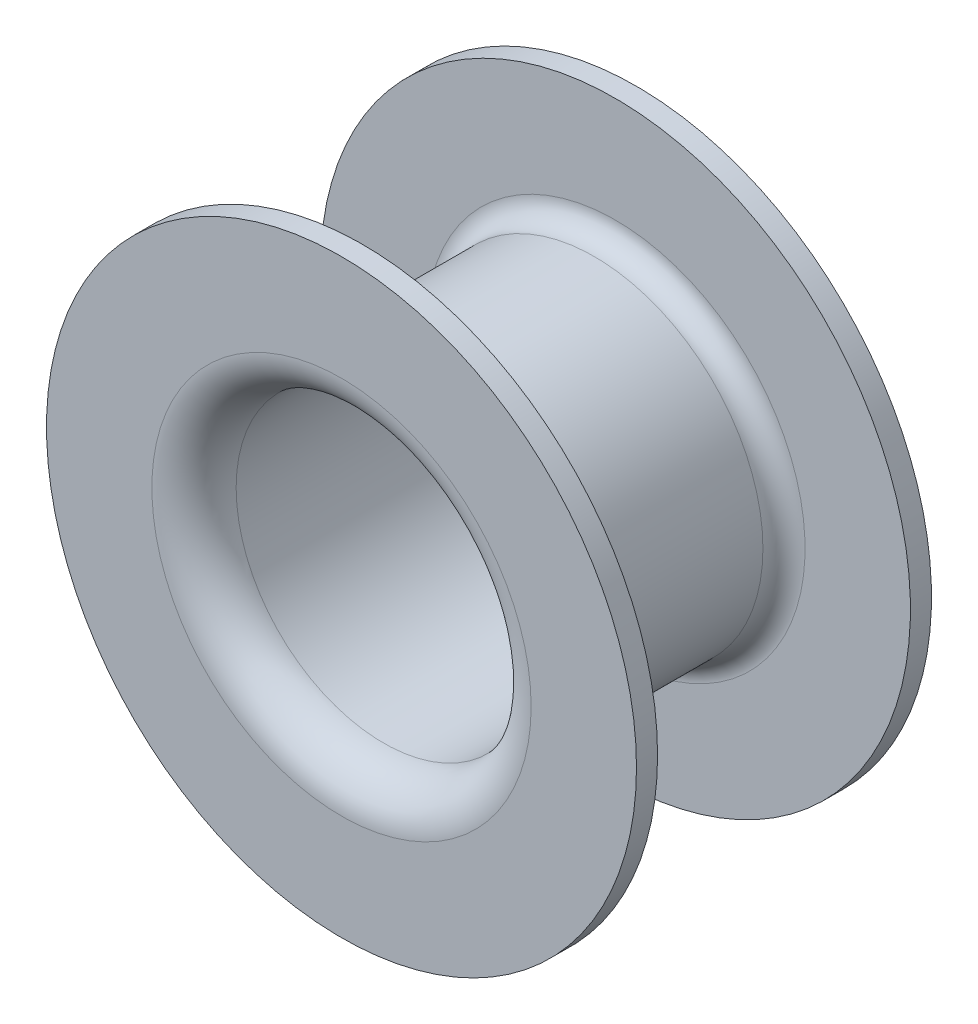
from build123d import *
from build123d.topology import SkipClean

# Parameters (mm, degrees)
SKETCH_1_R      = 3.5
SKETCH_1_R_2    = 1.75
EXTRUDE_1_DEPTH = 0.25
EXTRUDE_START   = 3
SKETCH_2_R      = 2
SKETCH_2_R_2    = 1.75
EXTRUDE_2_DEPTH = 3
EXTRUDE_START_2 = 0.25
SKETCH_3_R      = 3.5
SKETCH_3_R_2    = 1.75
EXTRUDE_3_DEPTH = 0.25
FILLET_1_R      = 0.25
FILLET_2_R      = 0.5


with BuildPart() as part:
    # Эскиз1 → Вытянуть1 (new body)
    with BuildSketch(Plane.XY):
        Circle(SKETCH_1_R)
        Circle(SKETCH_1_R_2, mode=Mode.SUBTRACT)
    extrude(amount=EXTRUDE_1_DEPTH)

    # Эскиз2 → Вытянуть2 (add)
    with SkipClean():  # the faces are left unmerged after this step: merging them gives an invalid solid
        with BuildSketch(Plane(origin=(0, 0, 0), x_dir=(-1, 0, 0), z_dir=(0, 0, -1)).offset(EXTRUDE_START)):
            with Locations(Location((0, 0, 0), (0, 0, 180))):
                Circle(SKETCH_2_R)
            Circle(SKETCH_2_R_2, mode=Mode.SUBTRACT)
        extrude(amount=-EXTRUDE_2_DEPTH)

    # Эскиз3 → Вытянуть3 (add)
    with SkipClean():  # the faces are left unmerged after this step: merging them gives an invalid solid
        with BuildSketch(Plane(origin=(0, 0, -3), x_dir=(-1, 0, 0), z_dir=(0, 0, -1)).offset(EXTRUDE_START_2)):
            with Locations(Location((0, 0, 0), (0, 0, 180))):
                Circle(SKETCH_3_R)
            Circle(SKETCH_3_R_2, mode=Mode.SUBTRACT)
        extrude(amount=-EXTRUDE_3_DEPTH)

    # Скругление1
    fillet_1_edges = [part.edges().sort_by_distance(p)[0] for p in [
        (-2, 0, -3),
        (-2, 0, 0),
    ]]
    fillet(fillet_1_edges, radius=FILLET_1_R)

    # Скругление2
    fillet_2_edges = [part.edges().sort_by_distance(p)[0] for p in [
        (1.75, 0, -3.25),
        (-1.75, 0, 0.25),
    ]]
    fillet(fillet_2_edges, radius=FILLET_2_R)


solid = part.part
